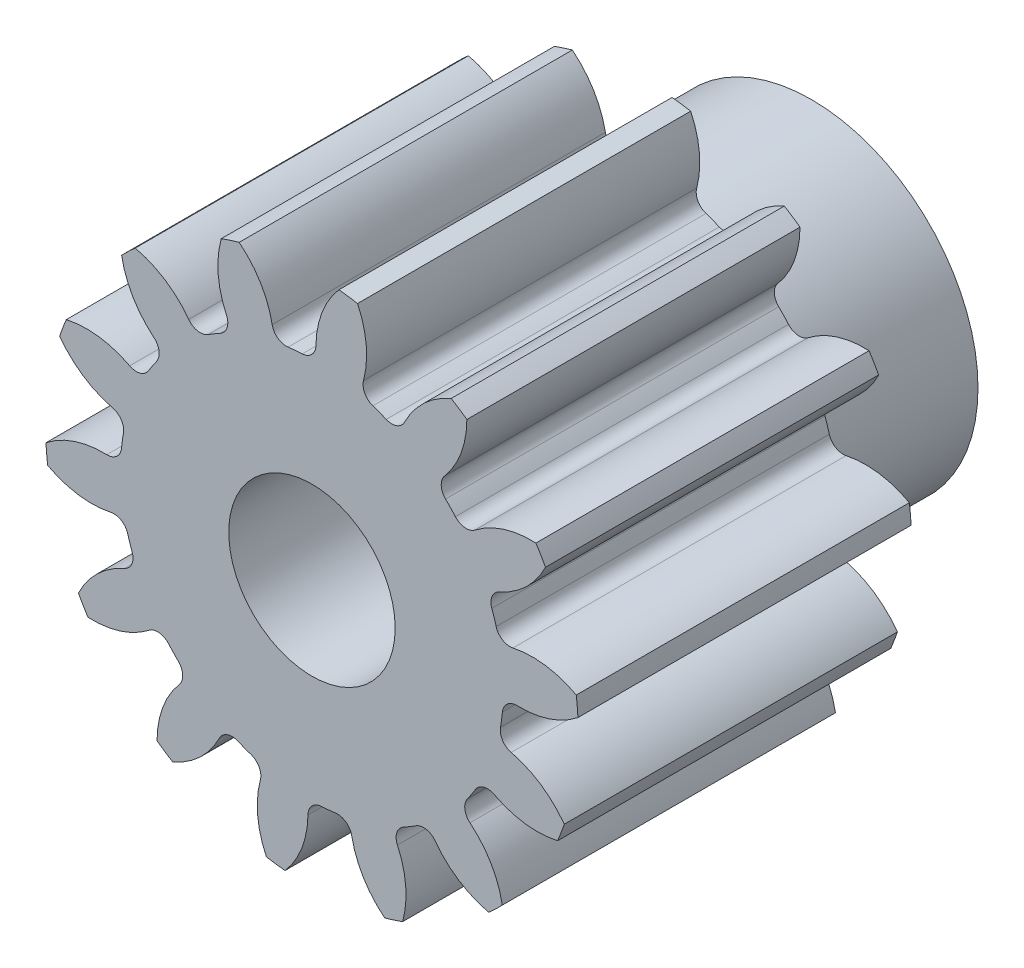
from build123d import *

# Parameters (mm, degrees)
SKETCH3_R         = 8
GEARBODY_DEPTH    = 10.007599831
TOOTHCUT_DEPTH    = 16.104703055
CIRPATTERN1_COUNT = 14
HUB1DIA_R         = 5
HUB1_DEPTH        = 5
BOREDIA_R         = 2.5
BORE_DEPTH        = 12700


with BuildPart() as part:
    # Sketch3 → gearBody (new body)
    with BuildSketch(Plane.XY):
        Circle(SKETCH3_R)
    extrude(amount=GEARBODY_DEPTH)

    # Sketch2 → toothCut (cut, through all)
    with BuildSketch(Plane.XY):
        with BuildLine():
            ThreePointArc((5.662427188, -0.995097475), (5.695585801, -0.783328174), (5.720827266, -0.570470007))
            ThreePointArc((5.720827266, -0.570470007), (5.866075375, -0.288673244), (6.164762022, -0.182406054))
            ThreePointArc((6.164762022, -0.182406054), (7.515972831, 0.115522232), (8.555782136, 1.028390528))
            ThreePointArc((8.555782136, 1.028390528), (8.537004601, -1.174115615), (7.960499295, -3.29991606))
            ThreePointArc((7.960499295, -3.29991606), (7.205732855, -2.14023527), (5.985118257, -1.488597397))
            ThreePointArc((5.985118257, -1.488597397), (5.726209027, -1.30564265), (5.662427188, -0.995097475))
        make_face()
    toothcut = extrude(amount=TOOTHCUT_DEPTH, mode=Mode.SUBTRACT)

    # CirPattern1: toothCut ×14 about axis
    cirpattern1_axis = Axis((0, 0, 10.007599831), (0, 0, -1))
    for i in range(1, CIRPATTERN1_COUNT):
        add(toothcut.rotate(cirpattern1_axis, i * 360 / CIRPATTERN1_COUNT), mode=Mode.SUBTRACT)

    # hub1Dia → hub1 (add)
    with BuildSketch(Plane(origin=(0, 0, 0), x_dir=(-1, 0, 0), z_dir=(0, 0, -1))):
        Circle(HUB1DIA_R)
    extrude(amount=HUB1_DEPTH)

    # boreDia → bore (cut, symmetric)
    with BuildSketch(Plane.XY):
        Circle(BOREDIA_R)
    extrude(amount=BORE_DEPTH, both=True, mode=Mode.SUBTRACT)


solid = part.part
